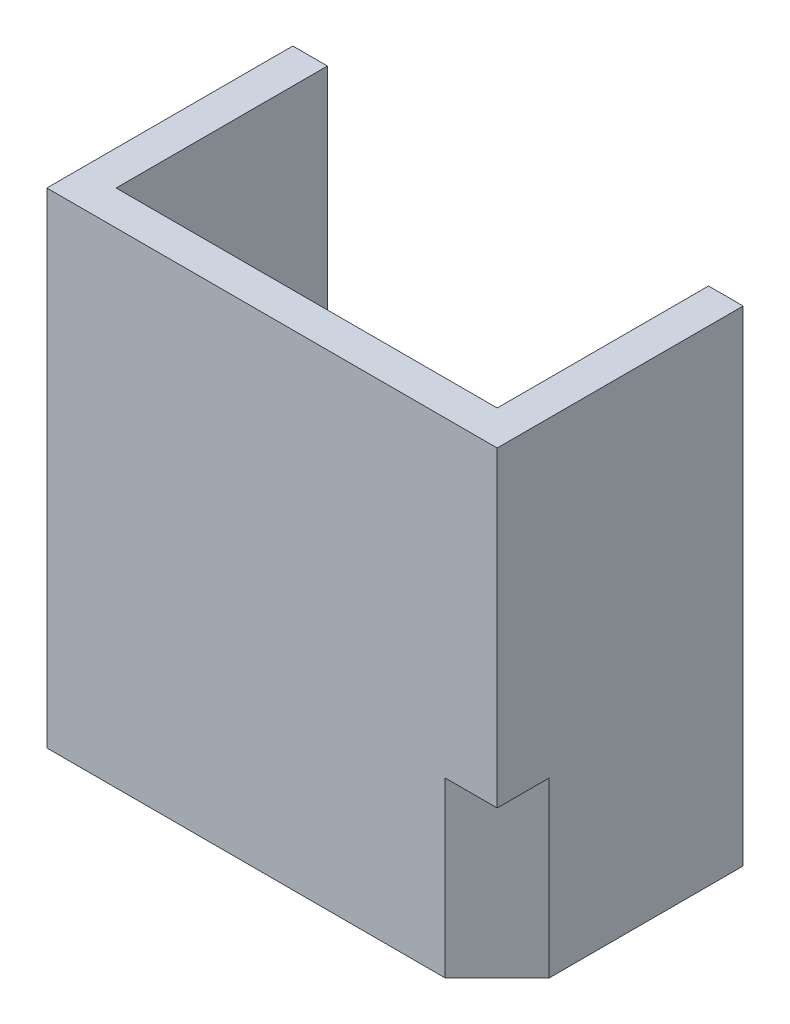
from build123d import *

# Parameters (mm, degrees)
SKETCH1_W           = 130
SKETCH1_H           = 90
BOSS_EXTRUDE1_DEPTH = 140
SKETCH3_W           = 110
SKETCH3_H           = 70
CUT_EXTRUDE1_DEPTH  = 212.187120819
SKETCH4_W           = 110
SKETCH4_H           = 70
SKETCH4_W_2         = 92
SKETCH4_H_2         = 52
BOSS_EXTRUDE2_DEPTH = 75
SKETCH5_W           = 110
SKETCH5_H           = 70
SKETCH5_W_2         = 92
SKETCH5_H_2         = 52
CUT_EXTRUDE2_DEPTH  = 65
SKETCH6_W           = 130
SKETCH6_H           = 140
CUT_EXTRUDE3_DEPTH  = 19
SKETCH7_W           = 92
SKETCH7_H           = 10
CUT_EXTRUDE4_DEPTH  = 9
CUT_EXTRUDE5_DEPTH  = 50


with BuildPart() as part:
    # Sketch1 → Boss-Extrude1 (new body)
    with BuildSketch(Plane(origin=(0, 0, 0), x_dir=(1, 0, 0), z_dir=(0, 1, 0))):
        with Locations((65, 45)):
            Rectangle(SKETCH1_W, SKETCH1_H)
    extrude(amount=BOSS_EXTRUDE1_DEPTH)

    # Sketch3 → Cut-Extrude1 (cut, through all)
    with BuildSketch(Plane(origin=(0, 140, 0), x_dir=(1, 0, 0), z_dir=(0, 1, 0))):
        with Locations((65, 45)):
            Rectangle(SKETCH3_W, SKETCH3_H)
    extrude(amount=-CUT_EXTRUDE1_DEPTH, mode=Mode.SUBTRACT)

    # Sketch4 → Boss-Extrude2 (add)
    with BuildSketch(Plane.XZ):
        with Locations((65, -45)):
            Rectangle(SKETCH4_W, SKETCH4_H)
        with Locations((65, -45)):
            Rectangle(SKETCH4_W_2, SKETCH4_H_2, mode=Mode.SUBTRACT)
    extrude(amount=-BOSS_EXTRUDE2_DEPTH)

    # Sketch5 → Cut-Extrude2 (cut)
    with BuildSketch(Plane.XZ):
        with Locations((65, -45)):
            Rectangle(SKETCH5_W, SKETCH5_H)
        with Locations((65, -45)):
            Rectangle(SKETCH5_W_2, SKETCH5_H_2, mode=Mode.SUBTRACT)
    extrude(amount=-CUT_EXTRUDE2_DEPTH, mode=Mode.SUBTRACT)

    # Sketch6 → Cut-Extrude3 (cut)
    with BuildSketch(Plane(origin=(0, 0, -90), x_dir=(-1, 0, 0), z_dir=(0, 0, -1))):
        with Locations((-65, 70)):
            Rectangle(SKETCH6_W, SKETCH6_H)
    extrude(amount=-CUT_EXTRUDE3_DEPTH, mode=Mode.SUBTRACT)

    # Sketch7 → Cut-Extrude4 (cut)
    with BuildSketch(Plane(origin=(0, 0, -19), x_dir=(-1, 0, 0), z_dir=(0, 0, -1))):
        with Locations((-65, 70)):
            Rectangle(SKETCH7_W, SKETCH7_H)
    extrude(amount=-CUT_EXTRUDE4_DEPTH, mode=Mode.SUBTRACT)

    # Sketch8 → Cut-Extrude5 (cut)
    with BuildSketch(Plane(origin=(0, 0, 0), x_dir=(1, 0, 0), z_dir=(0, 1, 0))):
        Polygon((130, 0), (130, 15), (115, 0), align=None)
    extrude(amount=CUT_EXTRUDE5_DEPTH, mode=Mode.SUBTRACT)


solid = part.part
